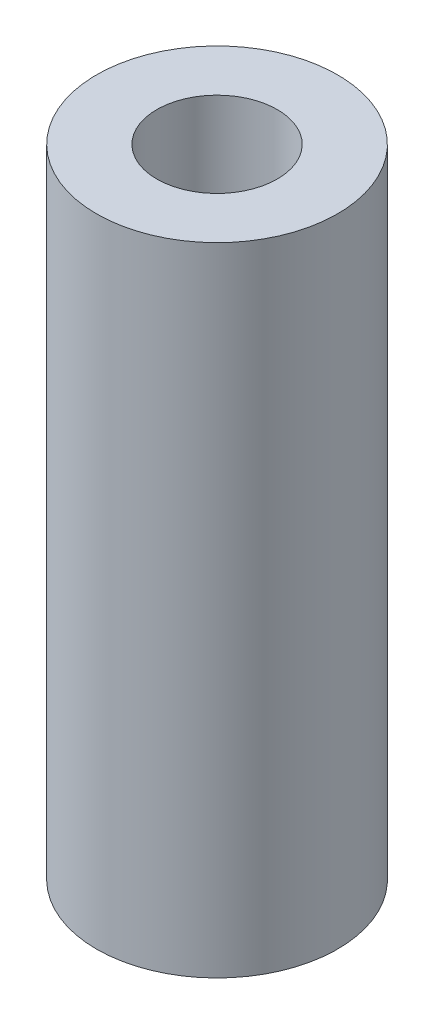
from build123d import *

# Parameters (mm, degrees)
SKETCH_1_R      = 3.5
SKETCH_1_R_2    = 1.75
EXTRUDE_1_DEPTH = 18.5


with BuildPart() as part:
    # 草图1 → 凸台-拉伸1 (new body)
    with BuildSketch(Plane(origin=(0, 0, 0), x_dir=(1, 0, 0), z_dir=(0, 1, 0))):
        with Locations(Location((0, 0, 0), (0, 0, 270))):
            Circle(SKETCH_1_R)
        with Locations(Location((0, 0, 0), (0, 0, 270))):
            Circle(SKETCH_1_R_2, mode=Mode.SUBTRACT)
    extrude(amount=EXTRUDE_1_DEPTH)


solid = part.part
